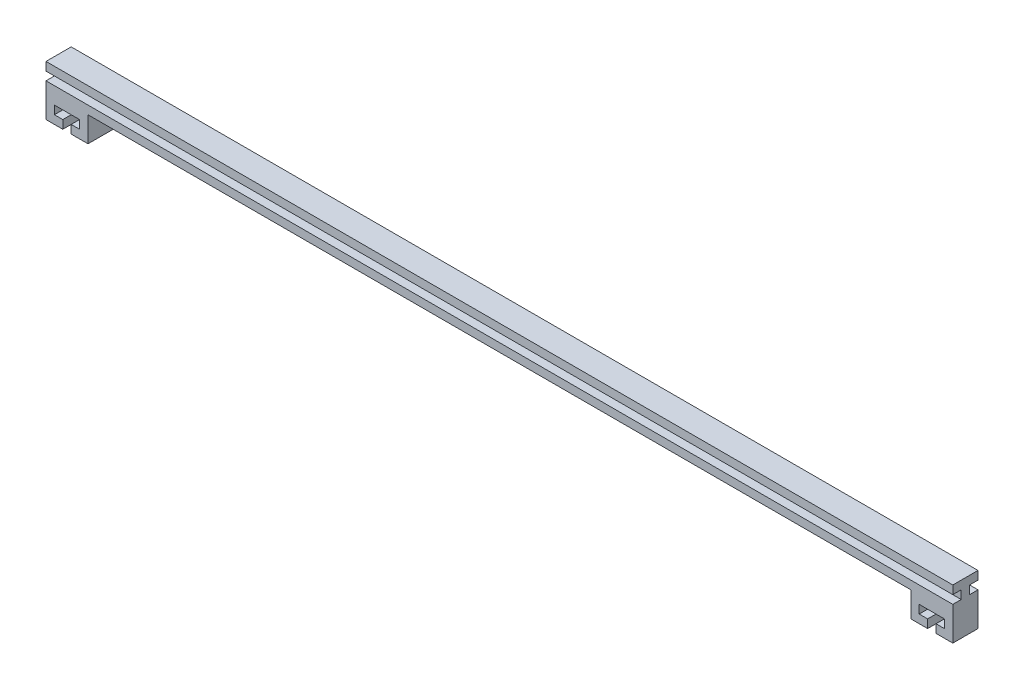
from build123d import *

# Parameters (mm, degrees)
BOSS_EXTRUDE1_DEPTH   = 150
BOSS_EXTRUDE1_2_DEPTH = 150
BOSS_EXTRUDE2_DEPTH   = 5400


with BuildPart() as part:
    # Sketch4 → Boss-Extrude1 (new body)
    with BuildSketch(Plane.XY):
        Polygon((-2550, 50), (-2550, 100), (-2500, 100), (-2500, 150), (-2650, 150), (-2650, 100), (-2600, 100), (-2600, 50), (-2700, 50), (-2700, 200), (-2450, 200), (-2450, 50), align=None)
    extrude(amount=BOSS_EXTRUDE1_DEPTH)



with BuildPart() as body_2:
    # Sketch4 → Boss-Extrude1 2 (new body)
    with BuildSketch(Plane.XY):
        Polygon((2600, 50), (2700, 50), (2700, 200), (2450, 200), (2450, 50), (2550, 50), (2550, 100), (2500, 100), (2500, 150), (2650, 150), (2650, 100), (2600, 100), align=None)
    extrude(amount=BOSS_EXTRUDE1_2_DEPTH)


with BuildPart() as part_1:
    add(part.part)

    add(body_2.part)  # Boss-Extrude2 merges body 2
    # Sketch5 → Boss-Extrude2 (add)
    with BuildSketch(Plane.ZY.offset(2700)):
        Polygon((0, 200), (150, 200), (150, 250), (100, 250), (100, 300), (150, 300), (150, 350), (0, 350), (0, 300), (50, 300), (50, 250), (0, 250), align=None)
    extrude(amount=-BOSS_EXTRUDE2_DEPTH)


solid = part_1.part
